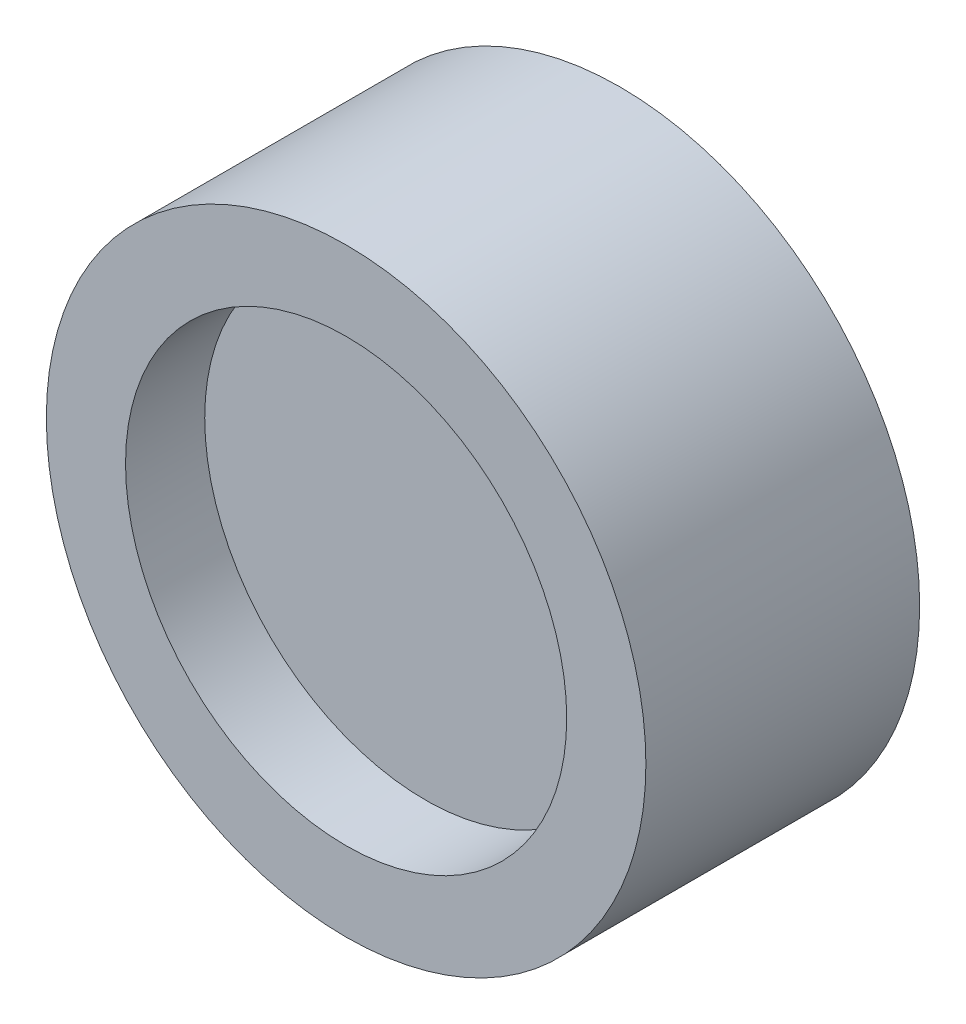
from build123d import *

# Parameters (mm, degrees)
SKETCH_1_R      = 26.5
SKETCH_1_R_2    = 19.5
EXTRUDE_1_DEPTH = 24.2
EXTRUDE_START   = -7
SKETCH_2_R      = 19.5
EXTRUDE_7_DEPTH = 10.2
SKETCH_4_R      = 3
EXTRUDE_8_DEPTH = 3


with BuildPart() as part:
    # ｽｹｯﾁ1 → ﾎﾞｽ - 押し出し1 (new body)
    with BuildSketch(Plane.XY):
        Circle(SKETCH_1_R)
        Circle(SKETCH_1_R_2, mode=Mode.SUBTRACT)
    extrude(amount=EXTRUDE_1_DEPTH)

    # ｽｹｯﾁ2 → ﾎﾞｽ - 押し出し7 (add)
    with BuildSketch(Plane(origin=(0, 0, 0), x_dir=(-1, 0, 0), z_dir=(0, 0, -1)).offset(EXTRUDE_START)):
        Circle(SKETCH_2_R)
    extrude(amount=-EXTRUDE_7_DEPTH)


with BuildPart() as body_2:
    # ｽｹｯﾁ4 → ﾎﾞｽ - 押し出し8 (new body)
    with BuildSketch(Plane(origin=(0, 0, 0), x_dir=(-1, 0, 0), z_dir=(0, 0, -1)).offset(EXTRUDE_START)):
        Circle(SKETCH_4_R)
    extrude(amount=EXTRUDE_8_DEPTH)


solid = Compound([part.part, body_2.part])
